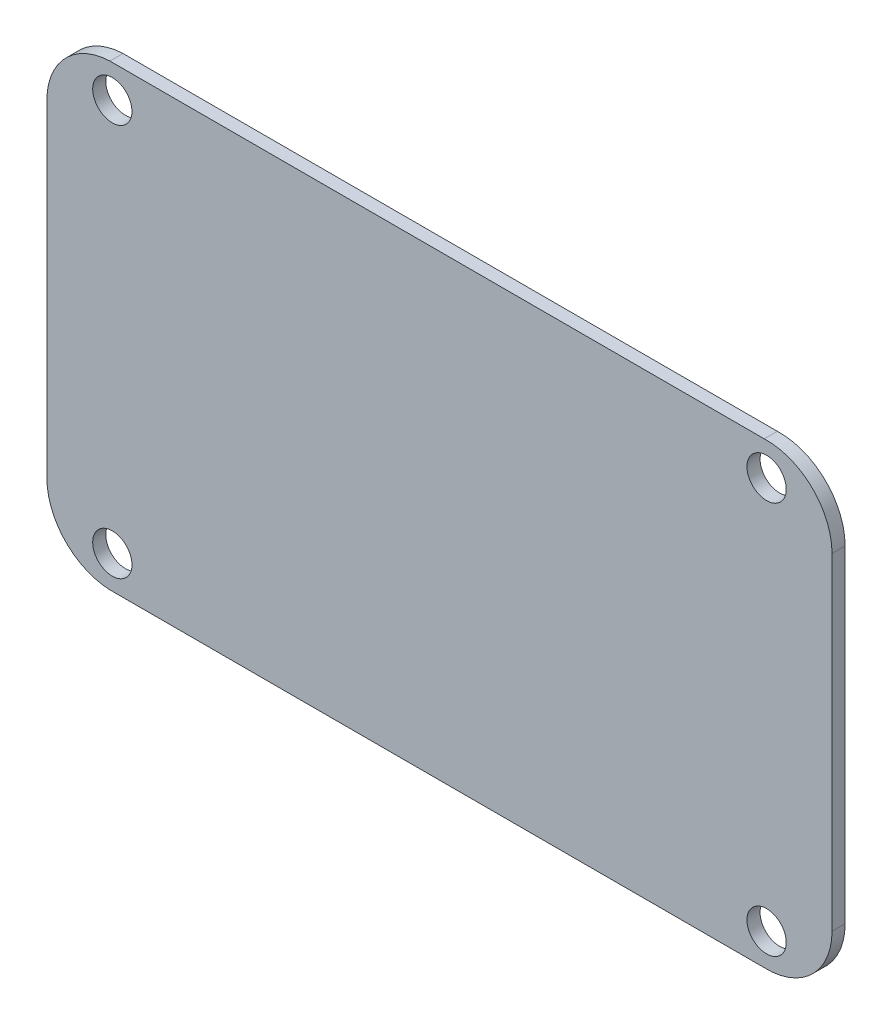
from build123d import *

# Parameters (mm, degrees)
BOSS_EXTRU_1_DEPTH      = 2
ESQUISSE2_R             = 3
ENL_V_MAT_EXTRU_1_DEPTH = 10


with BuildPart() as part:
    # Esquisse1 → Boss.-Extru.1 (new body)
    with BuildSketch(Plane.XY):
        with BuildLine():
            Line((-50.362843828, -35), (49.637156172, -35))
            ThreePointArc((49.637156172, -35), (56.943968893, -32.202509301), (60, -25))
            Line((60, -25), (60, 25))
            ThreePointArc((60, 25), (56.943968893, 32.202509301), (49.637156172, 35))
            Line((49.637156172, 35), (-50.362843828, 35))
            ThreePointArc((-50.362843828, 35), (-57.200495942, 31.945813173), (-60, 25))
            Line((-60, 25), (-60, -25))
            ThreePointArc((-60, -25), (-57.200495942, -31.945813173), (-50.362843828, -35))
        make_face()
    extrude(amount=BOSS_EXTRU_1_DEPTH)

    # Esquisse2 → Enlèv. mat.-Extru.1 (cut)
    with BuildSketch(Plane.XY.offset(2)):
        with Locations((-50, 30)):
            Circle(ESQUISSE2_R)
        with Locations((50, 30)):
            Circle(ESQUISSE2_R)
        with Locations((50, -30)):
            Circle(ESQUISSE2_R)
        with Locations((-50, -30)):
            Circle(ESQUISSE2_R)
    extrude(amount=-ENL_V_MAT_EXTRU_1_DEPTH, mode=Mode.SUBTRACT)


solid = part.part
